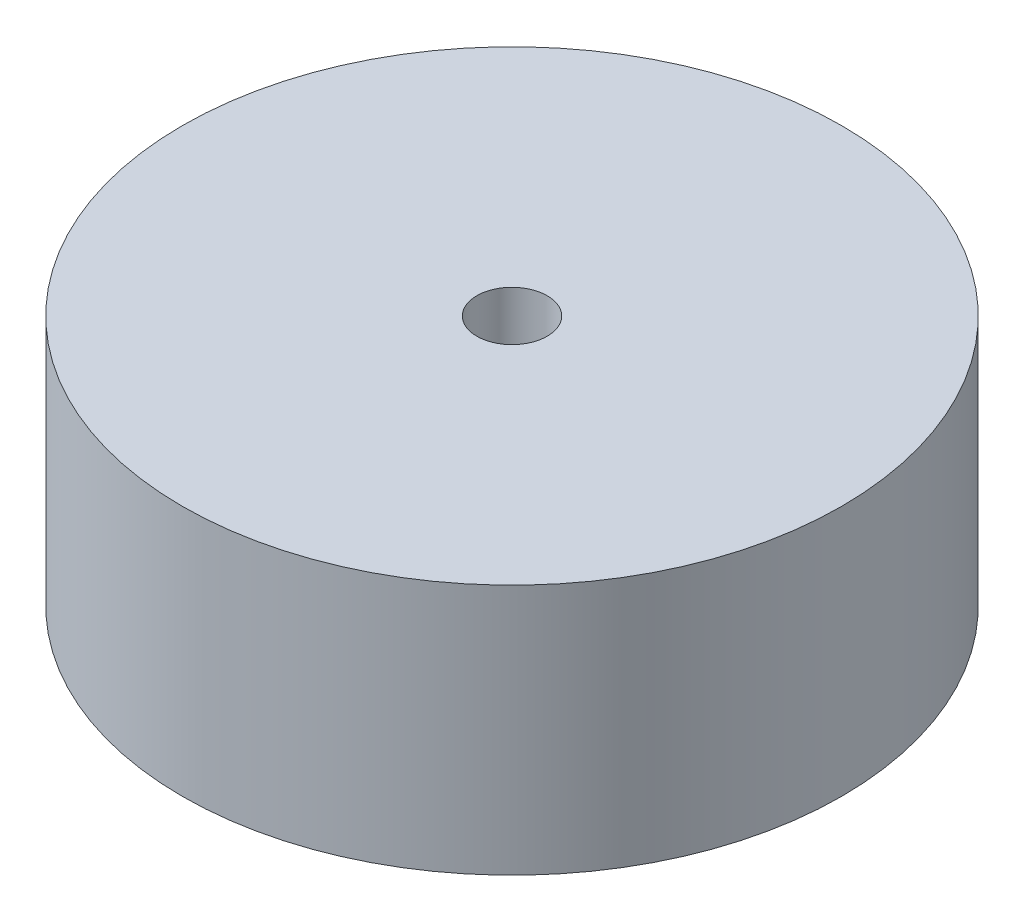
from build123d import *

# Parameters (mm, degrees)
SKETCH1_R           = 33.3375
BOSS_EXTRUDE1_DEPTH = 25.4
SKETCH2_R           = 3.556
CUT_EXTRUDE1_DEPTH  = 6.35


with BuildPart() as part:
    # Sketch1 → Boss-Extrude1 (new body)
    with BuildSketch(Plane(origin=(0, 0, 0), x_dir=(1, 0, 0), z_dir=(0, 1, 0))):
        with Locations(Location((0, 0, 0), (0, 0, 270))):
            Circle(SKETCH1_R)
    extrude(amount=BOSS_EXTRUDE1_DEPTH)

    # Sketch2 → Cut-Extrude1 (cut)
    with BuildSketch(Plane(origin=(0, 25.4, 0), x_dir=(1, 0, 0), z_dir=(0, 1, 0))):
        with Locations(Location((0, 0, 0), (0, 0, 270))):
            Circle(SKETCH2_R)
    extrude(amount=-CUT_EXTRUDE1_DEPTH, mode=Mode.SUBTRACT)


solid = part.part
